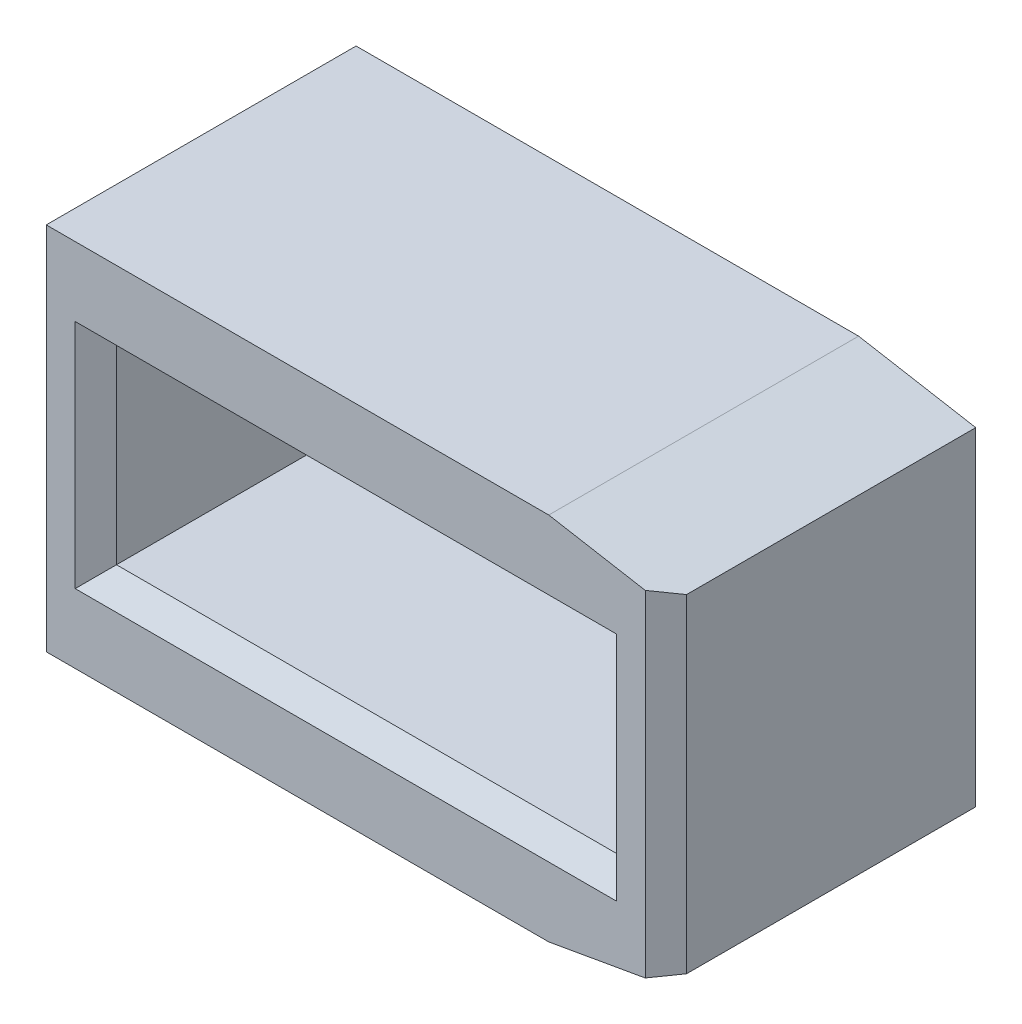
from build123d import *

# Parameters (mm, degrees)
SKETCH_1_W          = 60
SKETCH_1_H          = 35.8
EXTRUDE_1_DEPTH     = 30
SKETCH_2_W          = 50.4
SKETCH_2_H          = 18.4
CUT_EXTRUDE_1_DEPTH = 47.047909833
CHAMFER_1_SIZE      = 2
CHAMFER_1_SIZE2     = 11.342563639
CHAMFER_2_SIZE      = 2


with BuildPart() as part:
    # 草图1 → 凸台-拉伸1 (new body)
    with BuildSketch(Plane.XY):
        Rectangle(SKETCH_1_W, SKETCH_1_H)
    extrude(amount=EXTRUDE_1_DEPTH)

    # 草图2 → 切除-拉伸1 (cut, through all)
    with BuildSketch(Plane.XY.offset(30)):
        Rectangle(SKETCH_2_W, SKETCH_2_H)
    extrude(amount=-CUT_EXTRUDE_1_DEPTH, mode=Mode.SUBTRACT)

    # 倒角1
    chamfer_1_edges = [part.edges().sort_by_distance(p)[0] for p in [
        (30, -17.9, 15),
        (30, 17.9, 15),
    ]]
    chamfer_1_side = [part.faces().sort_by_distance(p)[0] for p in [
        (30, 0, 15),
    ]]
    chamfer(chamfer_1_edges, length=CHAMFER_1_SIZE, length2=CHAMFER_1_SIZE2, reference=chamfer_1_side[0])

    # 倒角2
    chamfer_2_edges = [part.edges().sort_by_distance(p)[0] for p in [
        (0, 9.2, 30),
        (-25.2, 0, 30),
        (0, -9.2, 30),
        (30, 0, 30),
    ]]
    chamfer(chamfer_2_edges, length=CHAMFER_2_SIZE)


solid = part.part
